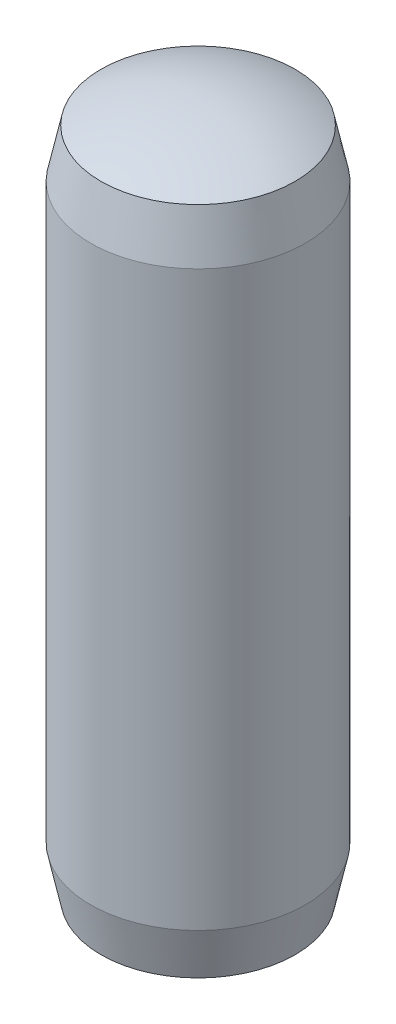
from build123d import *

# Parameters (mm, degrees)
SKETCH1_R           = 0.75
BOSS_EXTRUDE1_DEPTH = 5


with BuildPart() as part:
    # Sketch1 → Boss-Extrude1 (new body)
    with BuildSketch(Plane(origin=(0, 0, 0), x_dir=(1, 0, 0), z_dir=(0, 1, 0))):
        with Locations(Location((0, 0, 0), (0, 0, 270))):
            Circle(SKETCH1_R)
    extrude(amount=BOSS_EXTRUDE1_DEPTH)

    # Sketch2 → Cut-Revolve2 (revolve, cut)
    with BuildSketch(Plane.XY):
        with BuildLine():
            Line((0.75, 4.799038106), (0.75, 5.1))
            Line((0.75, 5.1), (0, 5.1))
            Line((0, 5.1), (0, 5))
            ThreePointArc((0, 5), (0.388228568, 4.948888739), (0.75, 4.799038106))
        make_face()
        with BuildLine():
            Line((0.75, -0.1), (0, -0.1))
            Line((0, -0.1), (0, 0))
            ThreePointArc((0, 0), (0.388228568, 0.051111261), (0.75, 0.200961894))
            Line((0.75, 0.200961894), (0.75, -0.1))
        make_face()
    revolve(axis=Axis((0, 0, 0), (0, 1, 0)), mode=Mode.SUBTRACT)

    # Sketch3 → Cut-Revolve3 (revolve, cut)
    with BuildSketch(Plane.XY, mode=Mode.PRIVATE) as cut_revolve3_sk:
        with BuildLine():
            Line((-0.75, 4.5), (-0.678168292, 4.837941616))
            ThreePointArc((-0.678168292, 4.837941616), (-0.714349031, 4.818978947), (-0.75, 4.799038106))
            Line((-0.75, 4.799038106), (-0.75, 4.5))
        make_face()
        with BuildLine():
            Line((-0.75, 0.200961894), (-0.75, 0.5))
            Line((-0.75, 0.5), (-0.678168292, 0.162058384))
            ThreePointArc((-0.678168292, 0.162058384), (-0.714349031, 0.181021053), (-0.75, 0.200961894))
        make_face()
    revolve(cut_revolve3_sk.sketch.rotate(Axis((0, 0, 0), (0, 1, 0)), 270), axis=Axis((0, 0, 0), (0, 1, 0)), mode=Mode.SUBTRACT)


solid = part.part
